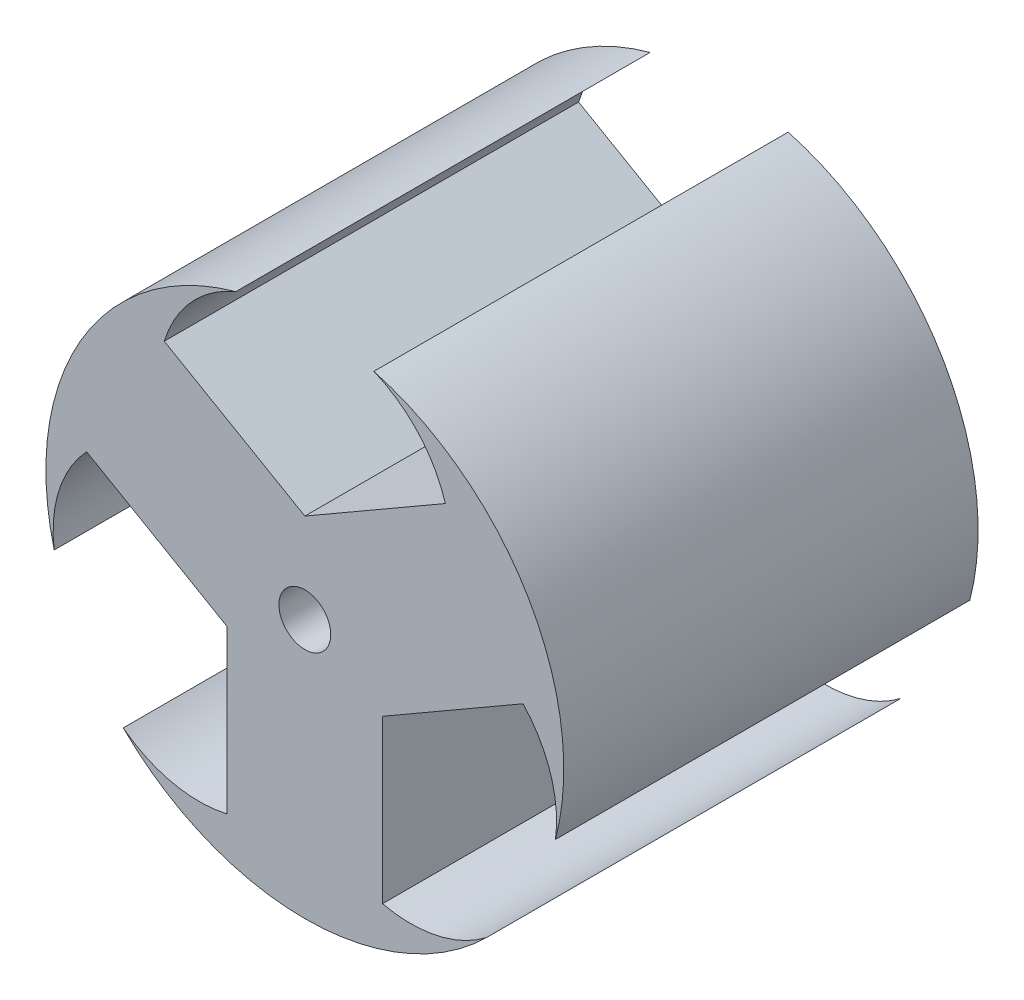
from build123d import *

# Parameters (mm, degrees)
SKETCH1_R           = 2.5
BOSS_EXTRUDE1_DEPTH = 40


with BuildPart() as part:
    # Sketch1 → Boss-Extrude1 (new body)
    # profile 1 of 7: a face of its own
    with BuildSketch(Plane.XY):
        with BuildLine():
            Line((-7.5, -4.330127019), (-7.5, 0))
            ThreePointArc((-7.5, 0), (-6.495190528, 3.75), (-3.75, 6.495190528))
            Line((-3.75, 6.495190528), (0, 8.660254038))
            Line((0, 8.660254038), (-13.570508076, 16.495190528))
            ThreePointArc((-13.570508076, 16.495190528), (-10.967861495, 21.068660914), (-6.663448066, 24.095610801))
            ThreePointArc((-6.663448066, 24.095610801), (-21.650635095, 12.5), (-24.199135106, -6.277090099))
            ThreePointArc((-24.199135106, -6.277090099), (-23.729926323, -1.035883777), (-21.070508076, 3.504809472))
            Line((-21.070508076, 3.504809472), (-7.5, -4.330127019))
        make_face()
    # profile 2 of 7: a face of its own
    with BuildSketch(Plane.XY):
        with BuildLine():
            Line((13.570508076, 16.495190528), (0, 8.660254038))
            Line((0, 8.660254038), (3.75, 6.495190528))
            ThreePointArc((3.75, 6.495190528), (6.495190528, 3.75), (7.5, 0))
            Line((7.5, 0), (7.5, -4.330127019))
            Line((7.5, -4.330127019), (21.070508076, 3.504809472))
            ThreePointArc((21.070508076, 3.504809472), (23.729926323, -1.035883777), (24.199135106, -6.277090099))
            ThreePointArc((24.199135106, -6.277090099), (21.650635095, 12.5), (6.663448066, 24.095610801))
            ThreePointArc((6.663448066, 24.095610801), (10.967861495, 21.068660914), (13.570508076, 16.495190528))
        make_face()
    # profile 3 of 7: a face of its own
    with BuildSketch(Plane.XY):
        with BuildLine():
            Line((-3.75, -6.495190528), (-7.5, -4.330127019))
            Line((-7.5, -4.330127019), (-7.5, -20))
            ThreePointArc((-7.5, -20), (-12.762064828, -20.032777137), (-17.53568704, -17.818520702))
            ThreePointArc((-17.53568704, -17.818520702), (0, -25), (17.53568704, -17.818520702))
            ThreePointArc((17.53568704, -17.818520702), (12.762064828, -20.032777137), (7.5, -20))
            Line((7.5, -20), (7.5, -4.330127019))
            Line((7.5, -4.330127019), (3.75, -6.495190528))
            ThreePointArc((3.75, -6.495190528), (0, -7.5), (-3.75, -6.495190528))
        make_face()
    # profile 4 of 7: a face of its own
    with BuildSketch(Plane.XY):
        with BuildLine():
            Line((0, 8.660254038), (-3.75, 6.495190528))
            ThreePointArc((-3.75, 6.495190528), (0, 7.5), (3.75, 6.495190528))
            Line((3.75, 6.495190528), (0, 8.660254038))
        make_face()
    # profile 5 of 7: a face of its own
    with BuildSketch(Plane.XY):
        with BuildLine():
            ThreePointArc((-3.75, -6.495190528), (-6.495190528, -3.75), (-7.5, 0))
            Line((-7.5, 0), (-7.5, -4.330127019))
            Line((-7.5, -4.330127019), (-3.75, -6.495190528))
        make_face()
    # profile 6 of 7: a face of its own
    with BuildSketch(Plane.XY):
        with BuildLine():
            ThreePointArc((7.5, 0), (6.495190528, -3.75), (3.75, -6.495190528))
            Line((3.75, -6.495190528), (7.5, -4.330127019))
            Line((7.5, -4.330127019), (7.5, 0))
        make_face()
    # profile 7 of 7: a face of its own
    with BuildSketch(Plane.XY):
        with BuildLine():
            ThreePointArc((-3.75, 6.495190528), (-6.495190528, 3.75), (-7.5, 0))
            ThreePointArc((-7.5, 0), (-6.495190528, -3.75), (-3.75, -6.495190528))
            ThreePointArc((-3.75, -6.495190528), (0, -7.5), (3.75, -6.495190528))
            ThreePointArc((3.75, -6.495190528), (6.495190528, -3.75), (7.5, 0))
            ThreePointArc((7.5, 0), (6.495190528, 3.75), (3.75, 6.495190528))
            ThreePointArc((3.75, 6.495190528), (0, 7.5), (-3.75, 6.495190528))
        make_face()
        Circle(SKETCH1_R, mode=Mode.SUBTRACT)
    extrude(amount=BOSS_EXTRUDE1_DEPTH)


solid = part.part
